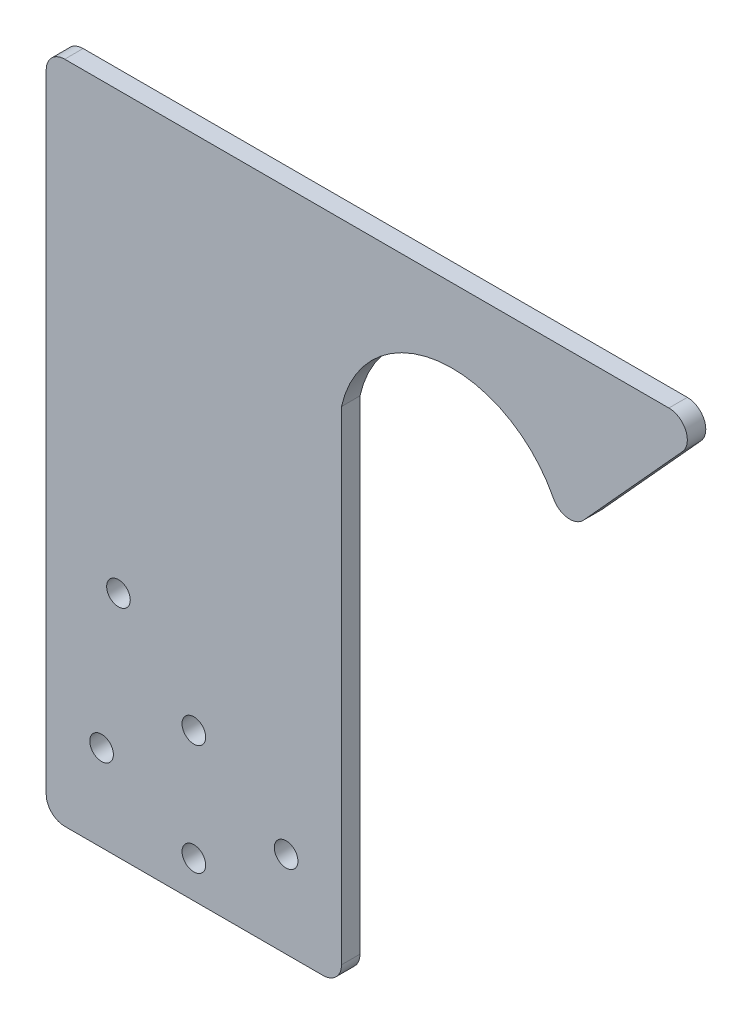
from build123d import *

# Parameters (mm, degrees)
SKETCH1_R           = 2.032
BOSS_EXTRUDE1_DEPTH = 3.175
FILLET1_R           = 3.175


with BuildPart() as part:
    # Sketch1 → Boss-Extrude1 (new body)
    with BuildSketch(Plane.XY):
        with BuildLine():
            Line((0, 114.3), (114.3, 114.3))
            Line((114.3, 114.3), (88.9, 86.353963576))
            ThreePointArc((88.9, 86.353963576), (69.85, 101.6), (50.8, 86.353963576))
            Line((50.8, 86.353963576), (50.8, 0))
            Line((50.8, 0), (0, 0))
            Line((0, 0), (0, 63.5))
            Line((0, 63.5), (0, 114.3))
        make_face()
        with Locations((9.525, 14.869716291)):
            Circle(SKETCH1_R, mode=Mode.SUBTRACT)
        with Locations((41.275, 14.869716291)):
            Circle(SKETCH1_R, mode=Mode.SUBTRACT)
        with Locations((25.4, 6.35)):
            Circle(SKETCH1_R, mode=Mode.SUBTRACT)
        with Locations((25.4, 25.4)):
            Circle(SKETCH1_R, mode=Mode.SUBTRACT)
        with Locations((12.432008635, 39.354701715)):
            Circle(SKETCH1_R, mode=Mode.SUBTRACT)
    extrude(amount=BOSS_EXTRUDE1_DEPTH)

    # Fillet1
    fillet1_edges = [part.edges().sort_by_distance(p)[0] for p in [
        (0, 114.3, 1.5875),
        (114.3, 114.3, 1.5875),
        (88.9, 86.353963576, 1.5875),
        (50.8, 0, 1.5875),
        (0, 0, 1.5875),
    ]]
    fillet(fillet1_edges, radius=FILLET1_R)


solid = part.part
